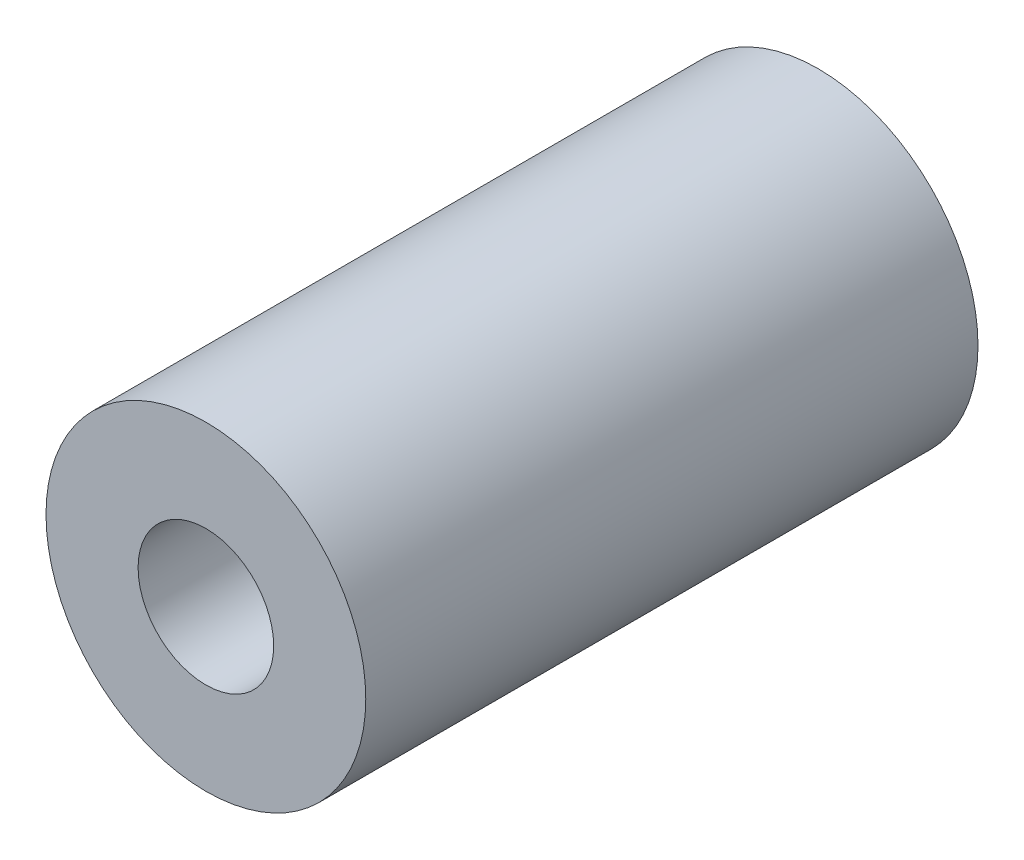
from build123d import *

# Parameters (mm, degrees)
SKETCH1_R                            = 4.7625
BOSS_EXTRUDE1_DEPTH                  = 9.1186
F_10_32_TAPPED_HOLE2_D               = 4.0386
F_10_32_TAPPED_HOLE2_DEPTH           = 15.07744
F_10_32_TAPPED_HOLE2_TIP             = 1.213317848
F_10_32_TAPPED_HOLE2_ON_FACE_2_D     = 4.0386
F_10_32_TAPPED_HOLE2_ON_FACE_2_DEPTH = 15.07744
F_10_32_TAPPED_HOLE2_ON_FACE_2_TIP   = 1.213317848


with BuildPart() as part:
    # Sketch1 → Boss-Extrude1 (new, symmetric)
    with BuildSketch(Plane.XY):
        with Locations(Location((0, 0, 0), (0, 0, 180))):
            Circle(SKETCH1_R)
    extrude(amount=BOSS_EXTRUDE1_DEPTH, both=True)

    # #10-32 Tapped Hole2
    with Locations(Plane.XY.offset(9.1186)):
        with Locations((0, 0)):
            Hole(F_10_32_TAPPED_HOLE2_D / 2, depth=F_10_32_TAPPED_HOLE2_DEPTH)
            with Locations((0, 0, -(F_10_32_TAPPED_HOLE2_DEPTH + F_10_32_TAPPED_HOLE2_TIP / 2))):  # 118° drill point
                Cone(0, F_10_32_TAPPED_HOLE2_D / 2, F_10_32_TAPPED_HOLE2_TIP, mode=Mode.SUBTRACT)

    # #10-32 Tapped Hole2 on face 2
    with Locations(Plane(origin=(0, 0, -9.1186), x_dir=(-1, 0, 0), z_dir=(0, 0, -1))):
        with Locations((0, 0)):
            Hole(F_10_32_TAPPED_HOLE2_ON_FACE_2_D / 2, depth=F_10_32_TAPPED_HOLE2_ON_FACE_2_DEPTH)
            with Locations((0, 0, -(F_10_32_TAPPED_HOLE2_ON_FACE_2_DEPTH + F_10_32_TAPPED_HOLE2_ON_FACE_2_TIP / 2))):  # 118° drill point
                Cone(0, F_10_32_TAPPED_HOLE2_ON_FACE_2_D / 2, F_10_32_TAPPED_HOLE2_ON_FACE_2_TIP, mode=Mode.SUBTRACT)


solid = part.part
